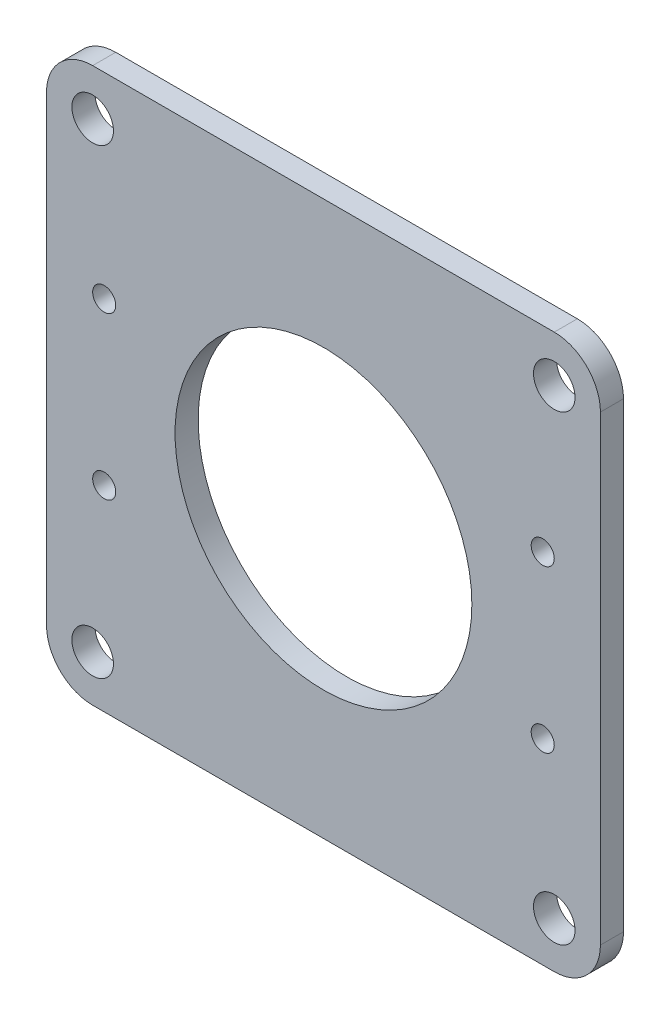
from build123d import *

# Parameters (mm, degrees)
SKETCH2_R           = 4.5
SKETCH2_R_2         = 2.5
SKETCH2_R_3         = 39
BOSS_EXTRUDE1_DEPTH = 5
BOSS_EXTRUDE2_START = -5
SKETCH3_R           = 39
SKETCH3_R_2         = 32.15
BOSS_EXTRUDE2_DEPTH = 5
SKETCH4_W           = 10
SKETCH4_H           = 120
CUT_EXTRUDE1_DEPTH  = 247.902363645
FILLET1_R           = 10


with BuildPart() as part:
    # Sketch2 → Boss-Extrude1 (new body)
    with BuildSketch(Plane.XY):
        Polygon((79.677872198, 233.639067486), (-60.322127802, 233.639067486), (-60.322127802, 223.639067486), (-60.322127802, 113.639067486), (79.677872198, 113.639067486), align=None)
        with Locations((-40.322127802, 123.639067486)):
            Circle(SKETCH2_R, mode=Mode.SUBTRACT)
        with Locations((-37.822127802, 156.139067486)):
            Circle(SKETCH2_R_2, mode=Mode.SUBTRACT)
        with Locations((59.677872198, 123.639067486)):
            Circle(SKETCH2_R, mode=Mode.SUBTRACT)
        with Locations((57.177872198, 156.139067486)):
            Circle(SKETCH2_R_2, mode=Mode.SUBTRACT)
        with Locations((-37.822127802, 191.139067486)):
            Circle(SKETCH2_R_2, mode=Mode.SUBTRACT)
        with Locations((9.677872198, 173.639067486)):
            Circle(SKETCH2_R_3, mode=Mode.SUBTRACT)
        with Locations((-40.322127802, 223.639067486)):
            Circle(SKETCH2_R, mode=Mode.SUBTRACT)
        with Locations((57.177872198, 191.139067486)):
            Circle(SKETCH2_R_2, mode=Mode.SUBTRACT)
        with Locations((59.677872198, 223.639067486)):
            Circle(SKETCH2_R, mode=Mode.SUBTRACT)
    extrude(amount=BOSS_EXTRUDE1_DEPTH)

    # Sketch3 → Boss-Extrude2 (add)
    with BuildSketch(Plane.XY.offset(5).offset(BOSS_EXTRUDE2_START)):
        with Locations((9.677872198, 173.639067486)):
            Circle(SKETCH3_R)
        with Locations((9.677872198, 173.639067486)):
            Circle(SKETCH3_R_2, mode=Mode.SUBTRACT)
    extrude(amount=BOSS_EXTRUDE2_DEPTH)

    # Sketch4 → Cut-Extrude1 (cut, through all)
    with BuildSketch(Plane.XY.offset(5)):
        with Locations((74.677872198, 173.639067486)):
            Rectangle(SKETCH4_W, SKETCH4_H)
        with Locations((-55.322127802, 173.639067486)):
            Rectangle(SKETCH4_W, SKETCH4_H)
    extrude(amount=-CUT_EXTRUDE1_DEPTH, mode=Mode.SUBTRACT)

    # Fillet1
    fillet1_edges = [part.edges().sort_by_distance(p)[0] for p in [
        (-50.322127802, 233.639067486, 2.5),
        (-50.322127802, 113.639067486, 2.5),
        (69.677872198, 113.639067486, 2.5),
        (69.677872198, 233.639067486, 2.5),
    ]]
    fillet(fillet1_edges, radius=FILLET1_R)


solid = part.part
